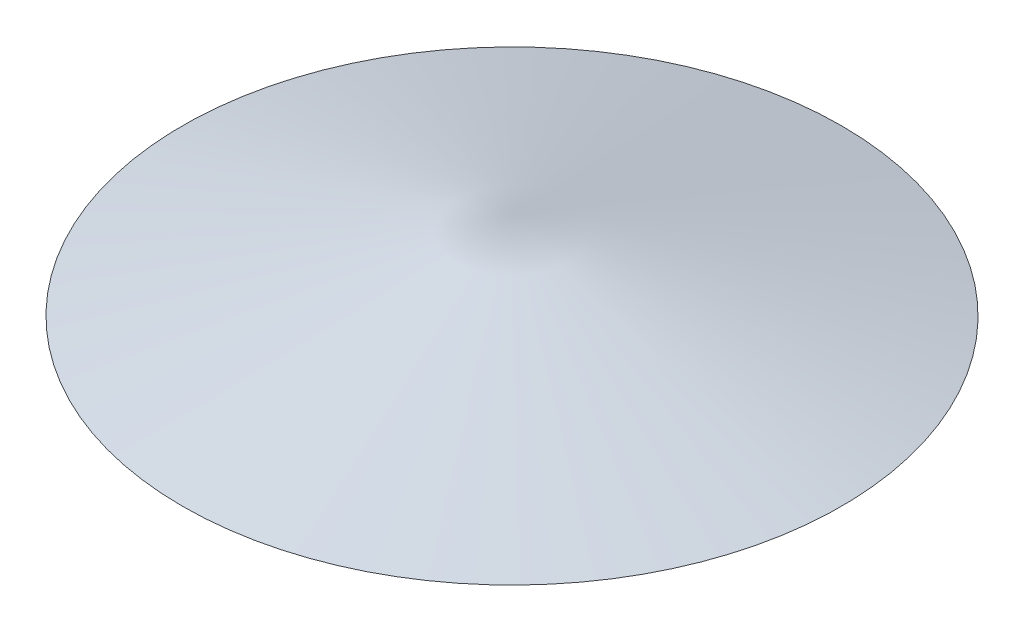
from build123d import *


with BuildPart() as part:
    # Esboço1 → Revolução1 (revolve)
    with BuildSketch(Plane.XY, mode=Mode.PRIVATE) as revolu_o1_sk:
        Polygon((0, 0), (0, 200), (746.410161514, 0), align=None)
    revolve(revolu_o1_sk.sketch.rotate(Axis((0, 0, 0), (0, 1, 0)), 90), axis=Axis((0, 0, 0), (0, 1, 0)))


solid = part.part
